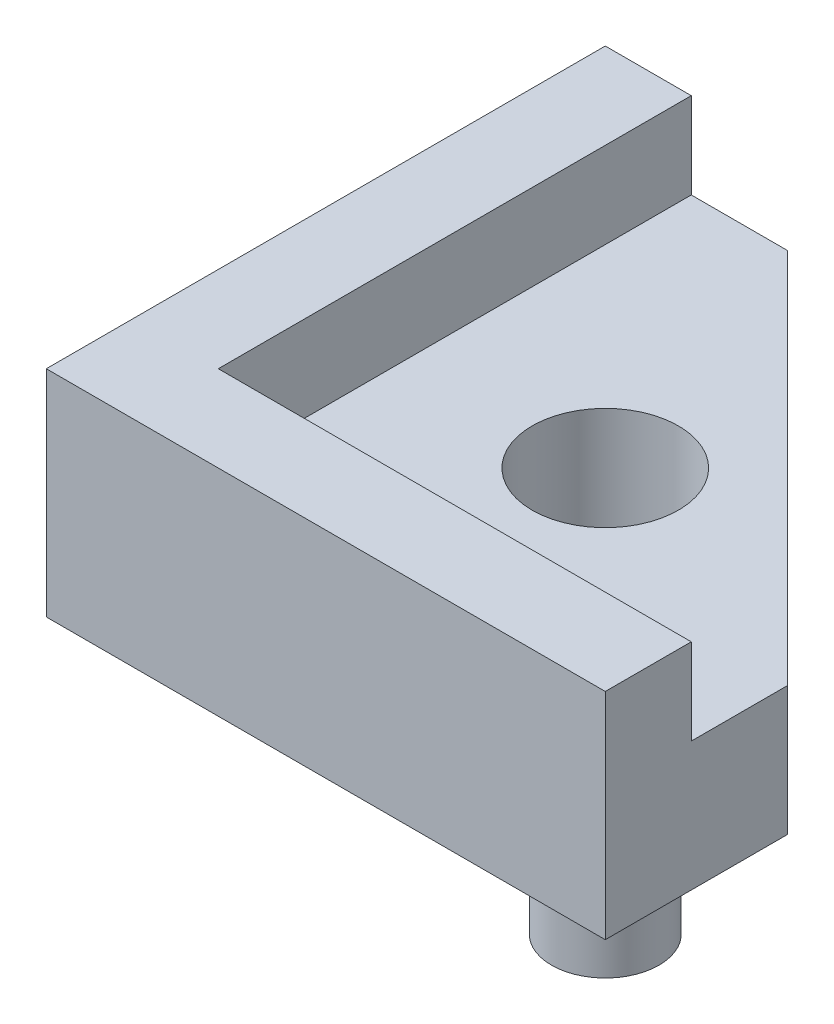
from build123d import *

# Parameters (mm, degrees)
BOSS_EXTRUDE2_DEPTH = 3
SKETCH4_R           = 1.25
BOSS_EXTRUDE3_DEPTH = 2.5
BOSS_EXTRUDE4_DEPTH = 2
CUT_EXTRUDE1_REACH  = 17.835
SKETCH6_R           = 1.7


with BuildPart() as part:
    # Sketch3 → Boss-Extrude2 (new body)
    with BuildSketch(Plane(origin=(0, 0, 0), x_dir=(1, 0, 0), z_dir=(0, 1, 0))):
        Polygon((-2.5, 10.5), (-2.5, -2.5), (10.5, -2.5), (10.5, 1.742640687), (1.742640687, 10.5), align=None)
    extrude(amount=-BOSS_EXTRUDE2_DEPTH)

    # Sketch4 → Boss-Extrude3 (add)
    with BuildSketch(Plane.XZ.offset(3)):
        with Locations(Location((7.889087297, -0.110912703, 0), (0, 0, 90))):
            Circle(SKETCH4_R)
        with Locations(Location((0.110912703, -7.889087297, 0), (0, 0, 90))):
            Circle(SKETCH4_R)
    extrude(amount=BOSS_EXTRUDE3_DEPTH)

    # Sketch5 → Boss-Extrude4 (add)
    with BuildSketch(Plane(origin=(0, 0, 0), x_dir=(1, 0, 0), z_dir=(0, 1, 0))):
        Polygon((-2.5, 10.5), (-2.5, -2.5), (10.5, -2.5), (10.5, -0.5), (-0.5, -0.5), (-0.5, 10.5), align=None)
    extrude(amount=BOSS_EXTRUDE4_DEPTH)

    # Sketch6 → Cut-Extrude1 (cut, up to next)
    with BuildSketch(Plane(origin=(0, 0, 0), x_dir=(1, 0, 0), z_dir=(0, 1, 0)), mode=Mode.PRIVATE) as cut_extrude1_sk1:
        with Locations(Location((4, 4, 0), (0, 0, 270))):
            Circle(SKETCH6_R)
    cut_extrude1_tool1 = extrude(cut_extrude1_sk1.sketch, amount=-CUT_EXTRUDE1_REACH, mode=Mode.PRIVATE) & part.part
    add(cut_extrude1_tool1.solids().sort_by_distance((4, 0, -4))[0], mode=Mode.SUBTRACT)


solid = part.part
